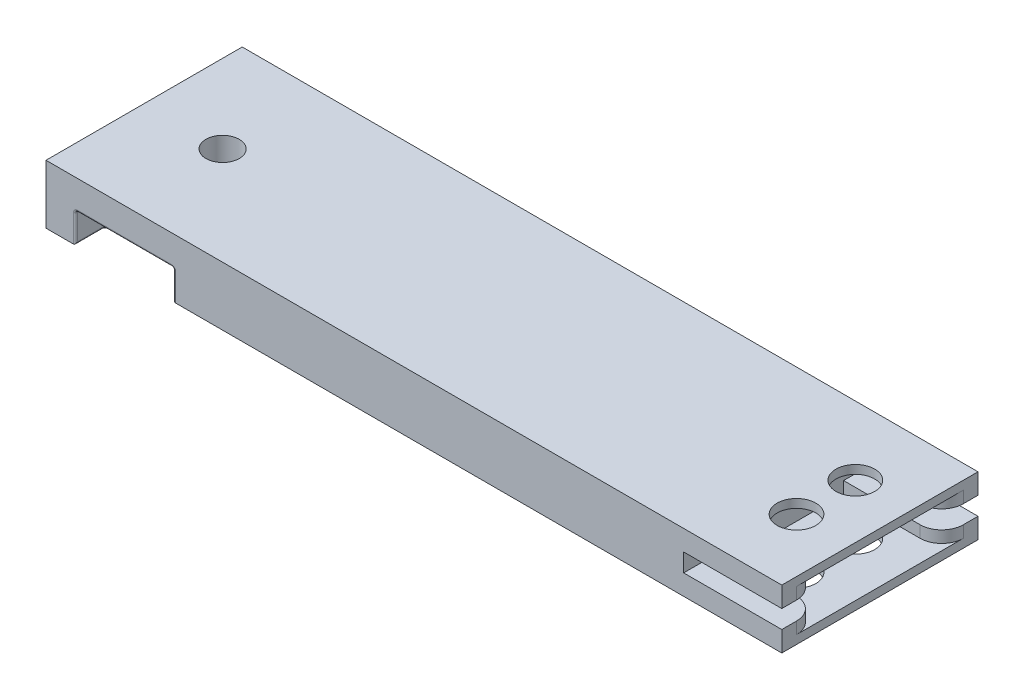
from build123d import *

# Parameters (mm, degrees)
SKETCH1_W            = 20
SKETCH1_H            = 6
BOSS_EXTRUDE1_DEPTH  = 75
M3_CLEARANCE_HOLE1_D = 3.4
SKETCH4_R            = 1.975
CUT_EXTRUDE1_DEPTH   = 76.901251637
CUT_EXTRUDE2_DEPTH   = 10
SKETCH6_W            = 10
SKETCH6_H            = 3
CUT_EXTRUDE3_DEPTH   = 3
FILLET1_R            = 0.2
FILLET2_R            = 2.2


with BuildPart() as part:
    # Sketch1 → Boss-Extrude1 (new body)
    with BuildSketch(Plane(origin=(0, 0, 0), x_dir=(0, 0, -1), z_dir=(1, 0, 0))):
        with Locations((0, -3)):
            Rectangle(SKETCH1_W, SKETCH1_H)
    extrude(amount=BOSS_EXTRUDE1_DEPTH)

    # M3 Clearance Hole1 (through all)
    with Locations(Plane(origin=(0, 0, 0), x_dir=(1, 0, 0), z_dir=(0, 1, 0))):
        with Locations((8, 0)):
            Hole(M3_CLEARANCE_HOLE1_D / 2)

    # Sketch4 → Cut-Extrude1 (cut, through all)
    with BuildSketch(Plane(origin=(0, 0, 0), x_dir=(1, 0, 0), z_dir=(0, 1, 0))):
        with Locations(Location((69.5, 3, 0), (0, 0, 270))):
            Circle(SKETCH4_R)
        with Locations(Location((69.5, -3, 0), (0, 0, 270))):
            Circle(SKETCH4_R)
    extrude(amount=-CUT_EXTRUDE1_DEPTH, mode=Mode.SUBTRACT)

    # Sketch5 → Cut-Extrude2 (cut)
    with BuildSketch(Plane(origin=(75, 0, 0), x_dir=(0, 0, -1), z_dir=(1, 0, 0))):
        Polygon((-10, -3.925), (-6.3, -3.925), (-6.3, -5.125), (6.3, -5.125), (6.3, -3.925), (10, -3.925), (10, -2.075), (6.3, -2.075), (6.3, -0.875), (-6.3, -0.875), (-6.3, -2.075), (-10, -2.075), align=None)
    extrude(amount=-CUT_EXTRUDE2_DEPTH, mode=Mode.SUBTRACT)

    # Sketch6 → Cut-Extrude3 (cut)
    with BuildSketch(Plane.XZ.offset(6)):
        with Locations((8, 8.5)):
            Rectangle(SKETCH6_W, SKETCH6_H)
        with Locations((8, -8.5)):
            Rectangle(SKETCH6_W, SKETCH6_H)
    extrude(amount=-CUT_EXTRUDE3_DEPTH, mode=Mode.SUBTRACT)

    # Fillet1
    fillet1_edges = [part.edges().sort_by_distance(p)[0] for p in [
        (3, -3, 8.5),
        (3, -4.5, 7),
        (8, -3, 10),
        (3, -4.5, 10),
        (13, -3, 8.5),
        (13, -4.5, 10),
        (8, -3, 7),
        (13, -4.5, 7),
        (3, -6, 8.5),
        (8, -6, 7),
        (13, -6, 8.5),
        (13, -3, -8.5),
        (13, -4.5, -7),
        (8, -3, -10),
        (13, -4.5, -10),
        (3, -3, -8.5),
        (3, -4.5, -10),
        (8, -3, -7),
        (3, -4.5, -7),
        (13, -6, -8.5),
        (8, -6, -7),
        (3, -6, -8.5),
    ]]
    fillet(fillet1_edges, radius=FILLET1_R)

    # Fillet2
    fillet2_edges = [part.edges().sort_by_distance(p)[0] for p in [
        (75, -1.475, -6.3),
        (75, -1.475, 6.3),
        (75, -4.525, 6.3),
        (75, -4.525, -6.3),
    ]]
    fillet(fillet2_edges, radius=FILLET2_R)


solid = part.part
